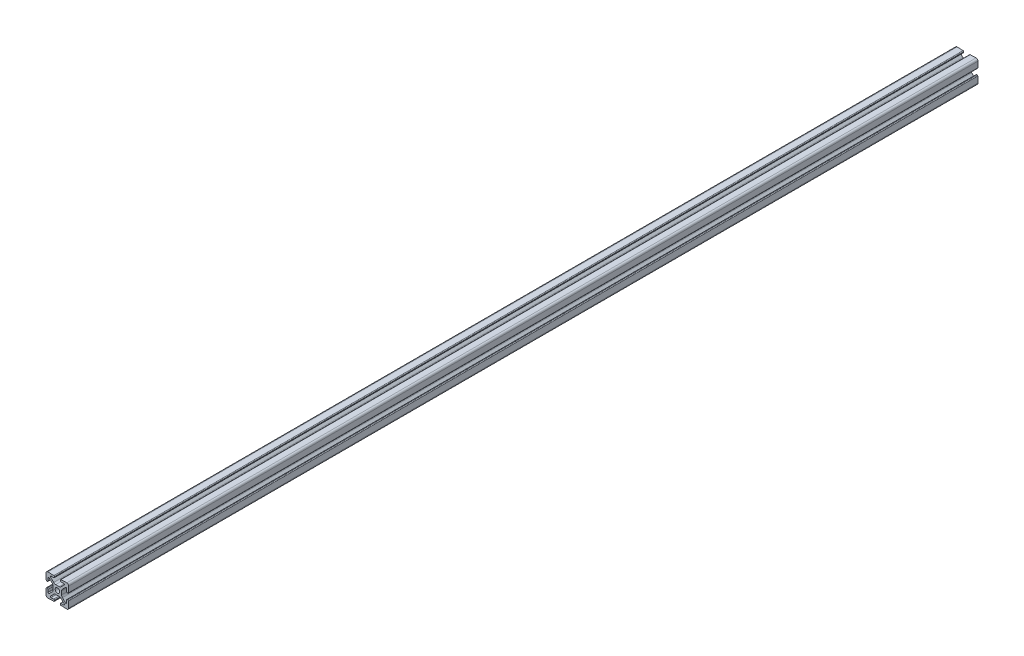
from build123d import *

# Parameters (mm, degrees)
BOSS_EXTRUDE1_DEPTH = 457.2
CIRPATTERN1_COUNT   = 4
BOSS_EXTRUDE2_START = 101.6
SKETCH4_R           = 2.54
BOSS_EXTRUDE2_DEPTH = 101.6


with BuildPart() as part:
    # Sketch3 → Boss-Extrude1 (new, symmetric)
    with BuildSketch(Plane.XY):
        with BuildLine():
            Line((0, 4.7625), (-1.884807374, 4.7625))
            ThreePointArc((-1.884807374, 4.7625), (-3.099827272, 5.004182484), (-4.129871405, 5.69243597))
            Line((-4.129871405, 5.69243597), (-7.599623114, 9.162187679))
            ThreePointArc((-7.599623114, 9.162187679), (-7.759888701, 10.006330839), (-7.033220609, 10.464824259))
            Line((-7.033220609, 10.464824259), (-4.047481702, 10.360559959))
            ThreePointArc((-4.047481702, 10.360559959), (-3.501205536, 10.564804249), (-3.259352476, 11.095502353))
            Line((-3.259352476, 11.095502353), (-3.23896419, 11.679346474))
            ThreePointArc((-3.23896419, 11.679346474), (-3.443208479, 12.225622641), (-3.973906584, 12.467475701))
            Line((-3.973906584, 12.467475701), (-10.597084223, 12.698762161))
            ThreePointArc((-10.597084223, 12.698762161), (-12.104840979, 12.104840979), (-12.698762161, 10.597084223))
            Line((-12.698762161, 10.597084223), (-12.467475701, 3.973906584))
            ThreePointArc((-12.467475701, 3.973906584), (-12.225622641, 3.443208479), (-11.679346474, 3.23896419))
            Line((-11.679346474, 3.23896419), (-11.095502353, 3.259352476))
            ThreePointArc((-11.095502353, 3.259352476), (-10.564804249, 3.501205536), (-10.360559959, 4.047481702))
            Line((-10.360559959, 4.047481702), (-10.464824259, 7.033220609))
            ThreePointArc((-10.464824259, 7.033220609), (-10.006330839, 7.759888701), (-9.162187679, 7.599623114))
            Line((-9.162187679, 7.599623114), (-5.69243597, 4.129871405))
            ThreePointArc((-5.69243597, 4.129871405), (-5.004182484, 3.099827272), (-4.7625, 1.884807374))
            Line((-4.7625, 1.884807374), (-4.7625, 0))
            Line((-4.7625, 0), (-2.54, 0))
            ThreePointArc((-2.54, 0), (-1.796051224, 1.796051224), (0, 2.54))
            Line((0, 2.54), (0, 4.7625))
        make_face()
    boss_extrude1 = extrude(amount=BOSS_EXTRUDE1_DEPTH, both=True)

    # CirPattern1: Boss-Extrude1 ×4 about axis
    cirpattern1_axis = Axis((0, 0, 0), (0, 0, 1))
    for i in range(1, CIRPATTERN1_COUNT):
        add(boss_extrude1.rotate(cirpattern1_axis, i * 360 / CIRPATTERN1_COUNT))

    # Sketch4 → Boss-Extrude2 (add)
    with BuildSketch(Plane.XY.offset(457.2).offset(BOSS_EXTRUDE2_START)):
        with BuildLine():
            Line((1.884807374, 4.7625), (-1.884807374, 4.7625))
            ThreePointArc((-1.884807374, 4.7625), (-3.099827272, 5.004182484), (-4.129871405, 5.69243597))
            Line((-4.129871405, 5.69243597), (-7.599623114, 9.162187679))
            ThreePointArc((-7.599623114, 9.162187679), (-7.759888701, 10.006330839), (-7.033220609, 10.464824259))
            Line((-7.033220609, 10.464824259), (-4.047481702, 10.360559959))
            ThreePointArc((-4.047481702, 10.360559959), (-3.501205536, 10.564804249), (-3.259352476, 11.095502353))
            Line((-3.259352476, 11.095502353), (-3.23896419, 11.679346474))
            ThreePointArc((-3.23896419, 11.679346474), (-3.443208479, 12.225622641), (-3.973906584, 12.467475701))
            Line((-3.973906584, 12.467475701), (-10.597084223, 12.698762161))
            ThreePointArc((-10.597084223, 12.698762161), (-12.104840979, 12.104840979), (-12.698762161, 10.597084223))
            Line((-12.698762161, 10.597084223), (-12.467475701, 3.973906584))
            ThreePointArc((-12.467475701, 3.973906584), (-12.225622641, 3.443208479), (-11.679346474, 3.23896419))
            Line((-11.679346474, 3.23896419), (-11.095502353, 3.259352476))
            ThreePointArc((-11.095502353, 3.259352476), (-10.564804249, 3.501205536), (-10.360559959, 4.047481702))
            Line((-10.360559959, 4.047481702), (-10.464824259, 7.033220609))
            ThreePointArc((-10.464824259, 7.033220609), (-10.006330839, 7.759888701), (-9.162187679, 7.599623114))
            Line((-9.162187679, 7.599623114), (-5.69243597, 4.129871405))
            ThreePointArc((-5.69243597, 4.129871405), (-5.004182484, 3.099827272), (-4.7625, 1.884807374))
            Line((-4.7625, 1.884807374), (-4.7625, -1.884807374))
            ThreePointArc((-4.7625, -1.884807374), (-5.004182484, -3.099827272), (-5.69243597, -4.129871405))
            Line((-5.69243597, -4.129871405), (-9.162187679, -7.599623114))
            ThreePointArc((-9.162187679, -7.599623114), (-10.006330839, -7.759888701), (-10.464824259, -7.033220609))
            Line((-10.464824259, -7.033220609), (-10.360559959, -4.047481702))
            ThreePointArc((-10.360559959, -4.047481702), (-10.564804249, -3.501205536), (-11.095502353, -3.259352476))
            Line((-11.095502353, -3.259352476), (-11.679346474, -3.23896419))
            ThreePointArc((-11.679346474, -3.23896419), (-12.225622641, -3.443208479), (-12.467475701, -3.973906584))
            Line((-12.467475701, -3.973906584), (-12.698762161, -10.597084223))
            ThreePointArc((-12.698762161, -10.597084223), (-12.104840979, -12.104840979), (-10.597084223, -12.698762161))
            Line((-10.597084223, -12.698762161), (-3.973906584, -12.467475701))
            ThreePointArc((-3.973906584, -12.467475701), (-3.443208479, -12.225622641), (-3.23896419, -11.679346474))
            Line((-3.23896419, -11.679346474), (-3.259352476, -11.095502353))
            ThreePointArc((-3.259352476, -11.095502353), (-3.501205536, -10.564804249), (-4.047481702, -10.360559959))
            Line((-4.047481702, -10.360559959), (-7.033220609, -10.464824259))
            ThreePointArc((-7.033220609, -10.464824259), (-7.759888701, -10.006330839), (-7.599623114, -9.162187679))
            Line((-7.599623114, -9.162187679), (-4.129871405, -5.69243597))
            ThreePointArc((-4.129871405, -5.69243597), (-3.099827272, -5.004182484), (-1.884807374, -4.7625))
            Line((-1.884807374, -4.7625), (1.884807374, -4.7625))
            ThreePointArc((1.884807374, -4.7625), (3.099827272, -5.004182484), (4.129871405, -5.69243597))
            Line((4.129871405, -5.69243597), (7.599623114, -9.162187679))
            ThreePointArc((7.599623114, -9.162187679), (7.759888701, -10.006330839), (7.033220609, -10.464824259))
            Line((7.033220609, -10.464824259), (4.047481702, -10.360559959))
            ThreePointArc((4.047481702, -10.360559959), (3.501205536, -10.564804249), (3.259352476, -11.095502353))
            Line((3.259352476, -11.095502353), (3.23896419, -11.679346474))
            ThreePointArc((3.23896419, -11.679346474), (3.443208479, -12.225622641), (3.973906584, -12.467475701))
            Line((3.973906584, -12.467475701), (10.597084223, -12.698762161))
            ThreePointArc((10.597084223, -12.698762161), (12.104840979, -12.104840979), (12.698762161, -10.597084223))
            Line((12.698762161, -10.597084223), (12.467475701, -3.973906584))
            ThreePointArc((12.467475701, -3.973906584), (12.225622641, -3.443208479), (11.679346474, -3.23896419))
            Line((11.679346474, -3.23896419), (11.095502353, -3.259352476))
            ThreePointArc((11.095502353, -3.259352476), (10.564804249, -3.501205536), (10.360559959, -4.047481702))
            Line((10.360559959, -4.047481702), (10.464824259, -7.033220609))
            ThreePointArc((10.464824259, -7.033220609), (10.006330839, -7.759888701), (9.162187679, -7.599623114))
            Line((9.162187679, -7.599623114), (5.69243597, -4.129871405))
            ThreePointArc((5.69243597, -4.129871405), (5.004182484, -3.099827272), (4.7625, -1.884807374))
            Line((4.7625, -1.884807374), (4.7625, 1.884807374))
            ThreePointArc((4.7625, 1.884807374), (5.004182484, 3.099827272), (5.69243597, 4.129871405))
            Line((5.69243597, 4.129871405), (9.162187679, 7.599623114))
            ThreePointArc((9.162187679, 7.599623114), (10.006330839, 7.759888701), (10.464824259, 7.033220609))
            Line((10.464824259, 7.033220609), (10.360559959, 4.047481702))
            ThreePointArc((10.360559959, 4.047481702), (10.564804249, 3.501205536), (11.095502353, 3.259352476))
            Line((11.095502353, 3.259352476), (11.679346474, 3.23896419))
            ThreePointArc((11.679346474, 3.23896419), (12.225622641, 3.443208479), (12.467475701, 3.973906584))
            Line((12.467475701, 3.973906584), (12.698762161, 10.597084223))
            ThreePointArc((12.698762161, 10.597084223), (12.104840979, 12.104840979), (10.597084223, 12.698762161))
            Line((10.597084223, 12.698762161), (3.973906584, 12.467475701))
            ThreePointArc((3.973906584, 12.467475701), (3.443208479, 12.225622641), (3.23896419, 11.679346474))
            Line((3.23896419, 11.679346474), (3.259352476, 11.095502353))
            ThreePointArc((3.259352476, 11.095502353), (3.501205536, 10.564804249), (4.047481702, 10.360559959))
            Line((4.047481702, 10.360559959), (7.033220609, 10.464824259))
            ThreePointArc((7.033220609, 10.464824259), (7.759888701, 10.006330839), (7.599623114, 9.162187679))
            Line((7.599623114, 9.162187679), (4.129871405, 5.69243597))
            ThreePointArc((4.129871405, 5.69243597), (3.099827272, 5.004182484), (1.884807374, 4.7625))
        make_face()
        with Locations(Location((0, 0, 0), (0, 0, 180))):
            Circle(SKETCH4_R, mode=Mode.SUBTRACT)
    extrude(amount=-BOSS_EXTRUDE2_DEPTH)


solid = part.part
